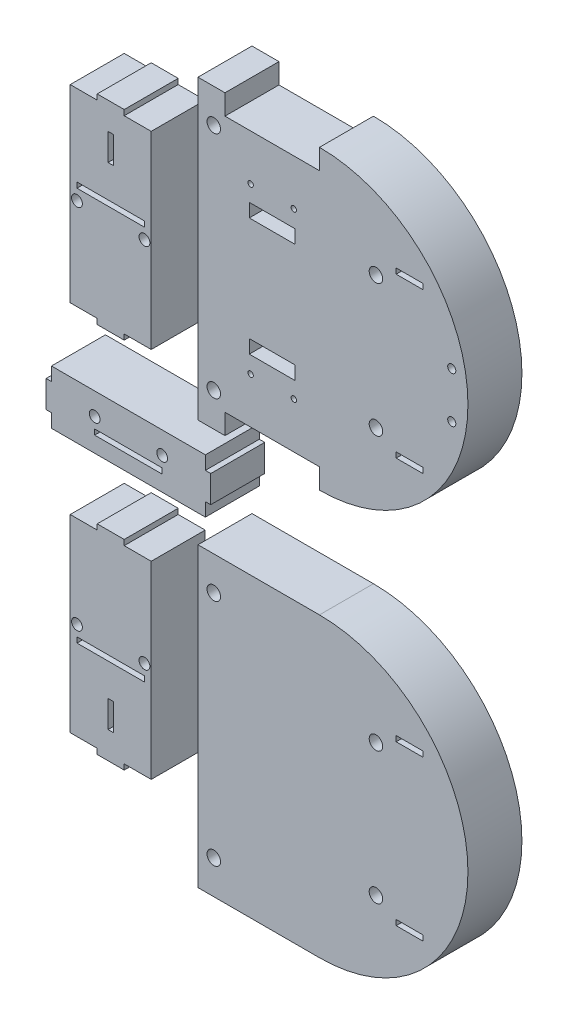
from build123d import *

# Parameters (mm, degrees)
SKETCH1_R             = 1
SKETCH1_R_2           = 1.5
SKETCH1_R_3           = 2.5
SKETCH1_W             = 10
SKETCH1_H             = 2
BOSS_EXTRUDE2_DEPTH   = 20
SKETCH1_R_4           = 2
SKETCH1_W_2           = 25
SKETCH1_W_3           = 2
SKETCH1_H_2           = 10
BOSS_EXTRUDE2_2_DEPTH = 20
BOSS_EXTRUDE2_3_DEPTH = 20
BOSS_EXTRUDE2_4_DEPTH = 20
BOSS_EXTRUDE2_5_DEPTH = 20


with BuildPart() as part:
    # Sketch1 → Boss-Extrude2 (new body)
    with BuildSketch(Plane.XY):
        with BuildLine():
            Line((-47.082296937, 60.111516097), (-47.082296937, -49.888483903))
            Line((-47.082296937, -49.888483903), (-37.082296937, -49.888483903))
            Line((-37.082296937, -49.888483903), (-37.082296937, -42.388483903))
            Line((-37.082296937, -42.388483903), (-2.082296937, -42.388483903))
            Line((-2.082296937, -42.388483903), (-2.082296937, -49.888483903))
            ThreePointArc((-2.082296937, -49.888483903), (52.917703063, 5.111516097), (-2.082296937, 60.111516097))
            Line((-2.082296937, 60.111516097), (-2.082296937, 52.611516097))
            Line((-2.082296937, 52.611516097), (-37.082296937, 52.611516097))
            Line((-37.082296937, 52.611516097), (-37.082296937, 60.111516097))
            Line((-37.082296937, 60.111516097), (-47.082296937, 60.111516097))
        make_face()
        with Locations((-27.582296937, 35.611516097)):
            Circle(SKETCH1_R, mode=Mode.SUBTRACT)
        with Locations((-11.582296937, 35.611516097)):
            Circle(SKETCH1_R, mode=Mode.SUBTRACT)
        with Locations((46.921812534, 13.611516097)):
            Circle(SKETCH1_R_2, mode=Mode.SUBTRACT)
        with Locations((-41.22607555, 47.611516097)):
            Circle(SKETCH1_R_3, mode=Mode.SUBTRACT)
        with Locations(Location((46.921812534, -3.388483903, 0), (0, 0, 180))):
            Circle(SKETCH1_R_2, mode=Mode.SUBTRACT)
        with Locations(Location((-11.582296937, -25.388483903, 0), (0, 0, 180))):
            Circle(SKETCH1_R, mode=Mode.SUBTRACT)
        with Locations(Location((-27.582296937, -25.388483903, 0), (0, 0, 180))):
            Circle(SKETCH1_R, mode=Mode.SUBTRACT)
        with Locations(Location((-41.22607555, -37.388483903, 0), (0, 0, 180))):
            Circle(SKETCH1_R_3, mode=Mode.SUBTRACT)
        with Locations((18.836987849, 29.611516097)):
            Circle(SKETCH1_R_3, mode=Mode.SUBTRACT)
        with Locations(Location((18.836987849, -19.388483903, 0), (0, 0, 180))):
            Circle(SKETCH1_R_3, mode=Mode.SUBTRACT)
        Polygon((-19.582296937, 29.45928137), (-28.082296937, 29.45928137), (-28.082296937, 24.45928137), (-11.082296937, 24.45928137), (-11.082296937, 29.45928137), align=None, mode=Mode.SUBTRACT)
        with Locations((31.336987849, 34.611516097)):
            Rectangle(SKETCH1_W, SKETCH1_H, mode=Mode.SUBTRACT)
        with Locations((31.336987849, -24.388483903)):
            Rectangle(SKETCH1_W, SKETCH1_H, mode=Mode.SUBTRACT)
        Polygon((-28.082296937, -14.236249177), (-28.082296937, -19.236249177), (-19.582296937, -19.236249177), (-11.082296937, -19.236249177), (-11.082296937, -14.236249177), align=None, mode=Mode.SUBTRACT)
    extrude(amount=BOSS_EXTRUDE2_DEPTH)


with BuildPart() as body_2:
    # Sketch1 → Boss-Extrude2 2 (new body)
    with BuildSketch(Plane.XY):
        Polygon((-94.412357347, -103.848430512), (-94.412357347, -173.848430512), (-84.412357347, -173.848430512), (-84.412357347, -175.848430512), (-74.412357347, -175.848430512), (-74.412357347, -173.848430512), (-64.412357347, -173.848430512), (-64.412357347, -103.848430512), (-74.412357347, -103.848430512), (-74.412357347, -101.848430512), (-84.412357347, -101.848430512), (-84.412357347, -103.848430512), align=None)
        with Locations((-66.912357347, -137.848430512)):
            Circle(SKETCH1_R_4, mode=Mode.SUBTRACT)
        with Locations((-91.912357347, -137.848430512)):
            Circle(SKETCH1_R_4, mode=Mode.SUBTRACT)
        with Locations((-79.412357347, -142.848430512)):
            Rectangle(SKETCH1_W_2, SKETCH1_H, mode=Mode.SUBTRACT)
        with Locations((-79.412357347, -160.848430512)):
            Rectangle(SKETCH1_W_3, SKETCH1_H_2, mode=Mode.SUBTRACT)
    extrude(amount=BOSS_EXTRUDE2_2_DEPTH)


with BuildPart() as body_3:
    # Sketch1 → Boss-Extrude2 3 (new body)
    with BuildSketch(Plane.XY):
        with BuildLine():
            Line((-47.082296937, -89.888483903), (-37.082296937, -89.888483903))
            Line((-37.082296937, -89.888483903), (-2.082296937, -89.888483903))
            ThreePointArc((-2.082296937, -89.888483903), (52.917703063, -144.888483903), (-2.082296937, -199.888483903))
            Line((-2.082296937, -199.888483903), (-37.082296937, -199.888483903))
            Line((-37.082296937, -199.888483903), (-47.082296937, -199.888483903))
            Line((-47.082296937, -199.888483903), (-47.082296937, -89.888483903))
        make_face()
        with Locations((18.836987849, -120.388483903)):
            Circle(SKETCH1_R_3, mode=Mode.SUBTRACT)
        with Locations(Location((18.836987849, -169.388483903, 0), (0, 0, 180))):
            Circle(SKETCH1_R_3, mode=Mode.SUBTRACT)
        with Locations((-41.22607555, -102.388483903)):
            Circle(SKETCH1_R_3, mode=Mode.SUBTRACT)
        with Locations(Location((-41.22607555, -187.388483903, 0), (0, 0, 180))):
            Circle(SKETCH1_R_3, mode=Mode.SUBTRACT)
        with Locations((31.336987849, -115.388483903)):
            Rectangle(SKETCH1_W, SKETCH1_H, mode=Mode.SUBTRACT)
        with Locations((31.336987849, -174.388483903)):
            Rectangle(SKETCH1_W, SKETCH1_H, mode=Mode.SUBTRACT)
    extrude(amount=BOSS_EXTRUDE2_3_DEPTH)


with BuildPart() as body_4:
    # Sketch1 → Boss-Extrude2 4 (new body)
    with BuildSketch(Plane.XY):
        Polygon((-101.357197908, -59.679261611), (-44.357197908, -59.679261611), (-44.357197908, -64.679261611), (-42.357197908, -64.679261611), (-42.357197908, -74.679261611), (-44.357197908, -74.679261611), (-44.357197908, -79.679261611), (-101.357197908, -79.679261611), (-101.357197908, -74.679261611), (-103.357197908, -74.679261611), (-103.357197908, -64.679261611), (-101.357197908, -64.679261611), align=None)
        with Locations((-60.357197908, -67.866957814)):
            Circle(SKETCH1_R_4, mode=Mode.SUBTRACT)
        with Locations((-85.357197908, -67.866957814)):
            Circle(SKETCH1_R_4, mode=Mode.SUBTRACT)
        with Locations((-72.857197908, -72.866957814)):
            Rectangle(SKETCH1_W_2, SKETCH1_H, mode=Mode.SUBTRACT)
    extrude(amount=BOSS_EXTRUDE2_4_DEPTH)


with BuildPart() as body_5:
    # Sketch1 → Boss-Extrude2 5 (new body)
    with BuildSketch(Plane.XY):
        Polygon((-74.412357347, 34.071462705), (-64.412357347, 34.071462705), (-64.412357347, -35.928537295), (-74.412357347, -35.928537295), (-74.412357347, -37.928537295), (-84.412357347, -37.928537295), (-84.412357347, -35.928537295), (-94.412357347, -35.928537295), (-94.412357347, 34.071462705), (-84.412357347, 34.071462705), (-84.412357347, 36.071462705), (-74.412357347, 36.071462705), align=None)
        with Locations(Location((-91.912357347, -1.928537295, 0), (0, 0, 180))):
            Circle(SKETCH1_R_4, mode=Mode.SUBTRACT)
        with Locations(Location((-66.912357347, -1.928537295, 0), (0, 0, 180))):
            Circle(SKETCH1_R_4, mode=Mode.SUBTRACT)
        with Locations((-79.412357347, 3.071462705)):
            Rectangle(SKETCH1_W_2, SKETCH1_H, mode=Mode.SUBTRACT)
        with Locations((-79.412357347, 21.071462705)):
            Rectangle(SKETCH1_W_3, SKETCH1_H_2, mode=Mode.SUBTRACT)
    extrude(amount=BOSS_EXTRUDE2_5_DEPTH)


solid = Compound([part.part, body_2.part, body_3.part, body_4.part, body_5.part])
